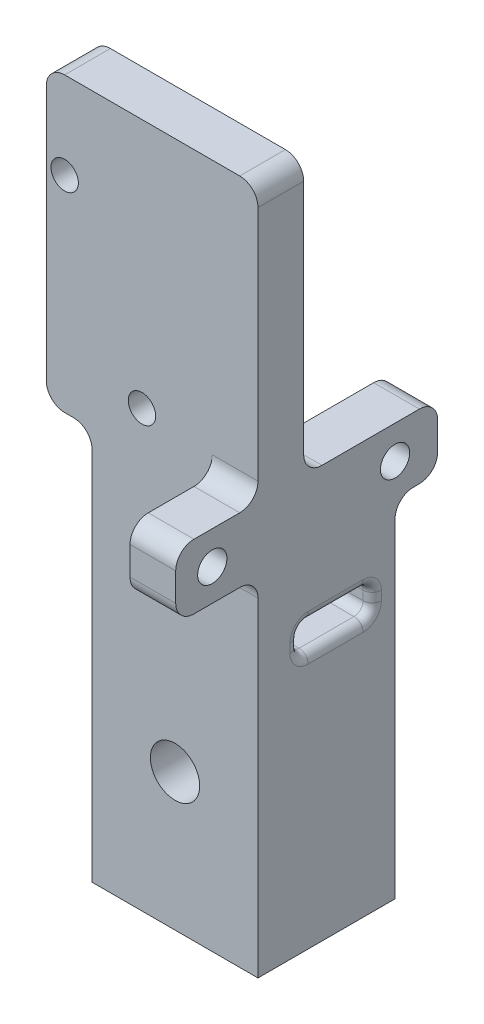
from build123d import *

# Parameters (mm, degrees)
SKETCH1_W           = 23.056445047489827
SKETCH1_H           = 95.25
SKETCH1_R           = 1.2700000000000005
SKETCH1_R_2         = 1.269999999999998
BOSS_EXTRUDE1_DEPTH = 6.35
SKETCH2_W           = 23.056445047489827
SKETCH2_H           = 48.26
BOSS_EXTRUDE2_DEPTH = 12.7
CUT_EXTRUDE2_DEPTH  = 55.41534970233967
SKETCH6_R           = 3.4289999999999994
CUT_EXTRUDE3_DEPTH  = 53.57321599024526
FILLET2_R           = 1.27
BOSS_EXTRUDE3_DEPTH = 6.35
SKETCH9_R           = 1.9049999999999996
SKETCH9_R_2         = 1.905
CUT_EXTRUDE4_DEPTH  = 53.43149307056342
FILLET4_R           = 2.54
BOSS_EXTRUDE7_DEPTH = 6.35
FILLET5_R           = 2.54
FILLET6_R           = 2.54
SKETCH13_R          = 2.0319999999999987
SKETCH13_R_2        = 2.032000000000001
CUT_EXTRUDE5_DEPTH  = 6.35
FILLET7_R           = 2.54


with BuildPart() as part:
    # Sketch1 → Boss-Extrude1 (new body)
    # profile 1 of 4: a face of its own
    with BuildSketch(Plane.XY):
        Rectangle(SKETCH1_W, SKETCH1_H)
        Polygon((7.9121000000000015, 16.687800000000006), (7.9121000000000015, 44.449999999999996), (-7.912099999999998, 44.45), (-7.912099999999998, 16.687800000000006), align=None, mode=Mode.SUBTRACT)
    # profile 2 of 4: a face of its own
    with BuildSketch(Plane.XY):
        Polygon((-7.912099999999998, 16.687800000000006), (7.9121000000000015, 16.687800000000006), (7.9121000000000015, 44.449999999999996), (-7.912099999999998, 44.45), align=None)
        with Locations((5.372100000000001, 19.227800000000006)):
            Circle(SKETCH1_R, mode=Mode.SUBTRACT)
        with Locations((-5.372099999999998, 41.910000000000004)):
            Circle(SKETCH1_R_2, mode=Mode.SUBTRACT)
    # profile 3 of 4: a face of its own
    with BuildSketch(Plane.XY):
        with Locations((-5.372099999999998, 41.910000000000004)):
            Circle(SKETCH1_R_2)
    # profile 4 of 4: a face of its own
    with BuildSketch(Plane.XY):
        with Locations((5.372100000000001, 19.227800000000006)):
            Circle(SKETCH1_R)
    extrude(amount=BOSS_EXTRUDE1_DEPTH)

    # Sketch2 → Boss-Extrude2 (add)
    with BuildSketch(Plane(origin=(0, 0, 0), x_dir=(-1, 0, 0), z_dir=(0, 0, -1))):
        with Locations((0, -23.495)):
            Rectangle(SKETCH2_W, SKETCH2_H)
    extrude(amount=BOSS_EXTRUDE2_DEPTH)

    # Sketch5 → Cut-Extrude2 (cut, through all)
    with BuildSketch(Plane(origin=(11.528222523744914, 0, 0), x_dir=(0, 0, -1), z_dir=(1, 0, 0))):
        Polygon((-0.6350000000000019, -12.065000000000001), (9.524999999999997, -12.065000000000001), (9.524999999999999, -8.255000000000003), (-0.6350000000000019, -8.255000000000003), align=None)
    extrude(amount=-CUT_EXTRUDE2_DEPTH, mode=Mode.SUBTRACT)

    # Sketch6 → Cut-Extrude3 (cut, through all)
    with BuildSketch(Plane(origin=(0, 0, -12.7), x_dir=(-1, 0, 0), z_dir=(0, 0, -1))):
        with Locations((0, -28.575)):
            Circle(SKETCH6_R)
    extrude(amount=-CUT_EXTRUDE3_DEPTH, mode=Mode.SUBTRACT)

    # Fillet2
    fillet2_edges = [part.edges().sort_by_distance(p)[0] for p in [
        (-11.528222523744914, -10.160000000000004, -9.524999999999999),
        (0, -8.255000000000003, -9.524999999999999),
        (-11.528222523744914, -12.065, -4.444999999999998),
        (0, -12.065000000000001, -9.524999999999997),
        (-11.528222523744914, -10.16, 0.6350000000000019),
        (0, -12.065000000000001, 0.6350000000000019),
        (-11.528222523744914, -8.255000000000003, -4.4449999999999985),
        (0, -8.255000000000003, 0.6350000000000019),
        (11.528222523744914, -10.160000000000002, -9.524999999999999),
        (11.528222523744914, -8.255000000000003, -4.4449999999999985),
        (11.528222523744914, -10.160000000000002, 0.6350000000000019),
        (11.528222523744914, -12.065000000000001, -4.444999999999998),
    ]]
    fillet(fillet2_edges, radius=FILLET2_R)

    # Sketch8 → Boss-Extrude3 (add)
    with BuildSketch(Plane.ZY.offset(11.528222523744914)):
        Polygon((6.35, 47.625), (-1.21e-15, 47.625), (0, 6.98625472546675), (6.350000000000005, 6.986254725466751), align=None)
    extrude(amount=BOSS_EXTRUDE3_DEPTH)

    # Sketch9 → Cut-Extrude4 (cut, through all)
    with BuildSketch(Plane.XY):
        with Locations((-4.594022523744915, 12.877800000000006)):
            Circle(SKETCH9_R)
        with Locations((-15.338222523744914, 35.56)):
            Circle(SKETCH9_R_2)
    extrude(amount=CUT_EXTRUDE4_DEPTH, mode=Mode.SUBTRACT)

    # Fillet4
    fillet4_edges = [part.edges().sort_by_distance(p)[0] for p in [
        (11.528222523744914, 47.625, 3.175),
        (-11.528222523744914, 6.98625472546675, 3.1750000000000025),
        (-17.878222523744913, 47.625, 3.1749999999999994),
        (-17.878222523744913, 6.98625472546675, 3.1750000000000025),
    ]]
    fillet(fillet4_edges, radius=FILLET4_R)

    # Sketch12 → Boss-Extrude7 (add)
    with BuildSketch(Plane(origin=(11.528222523744914, 0, 0), x_dir=(0, 0, -1), z_dir=(1, 0, 0))):
        Polygon((-6.35, 0.6349999999999898), (18.613653389650153, 0.6349999999999898), (18.613653389650153, 9.627193152709879), (-17.78195834691587, 9.627193152709879), (-17.78195834691587, 0.6349999999999898), align=None)
    extrude(amount=-BOSS_EXTRUDE7_DEPTH)

    # Fillet5
    fillet5_edges = [part.edges().sort_by_distance(p)[0] for p in [
        (8.353222523744913, 0.6349999999999967, -12.7),
        (8.353222523744915, 9.627193152709879, 6.3500000000000005),
        (8.353222523744915, 9.627193152709879, 0),
        (5.178222523744914, 5.131096576354938, 0),
        (8.353222523744915, 0.6349999999999898, 6.35),
    ]]
    fillet(fillet5_edges, radius=FILLET5_R)

    # Fillet6
    fillet6_edges = [part.edges().sort_by_distance(p)[0] for p in [
        (5.178222523744914, -0.6350000000000069, -12.7),
    ]]
    fillet(fillet6_edges, radius=FILLET6_R)

    # Sketch13 → Cut-Extrude5 (cut)
    with BuildSketch(Plane(origin=(11.528222523744914, 0, 0), x_dir=(0, 0, -1), z_dir=(1, 0, 0))):
        with Locations((-12.70195834691587, 5.050717249087455)):
            Circle(SKETCH13_R)
        with Locations((12.698041653084129, 5.050717249087455)):
            Circle(SKETCH13_R_2)
    extrude(amount=-CUT_EXTRUDE5_DEPTH, mode=Mode.SUBTRACT)

    # Fillet7
    fillet7_edges = [part.edges().sort_by_distance(p)[0] for p in [
        (8.353222523744915, 0.6349999999999898, -18.613653389650153),
        (8.353222523744915, 0.6349999999999898, 17.78195834691587),
        (8.353222523744915, 9.627193152709879, 17.78195834691587),
        (8.353222523744915, 9.627193152709879, -18.613653389650153),
    ]]
    fillet(fillet7_edges, radius=FILLET7_R)


solid = part.part
